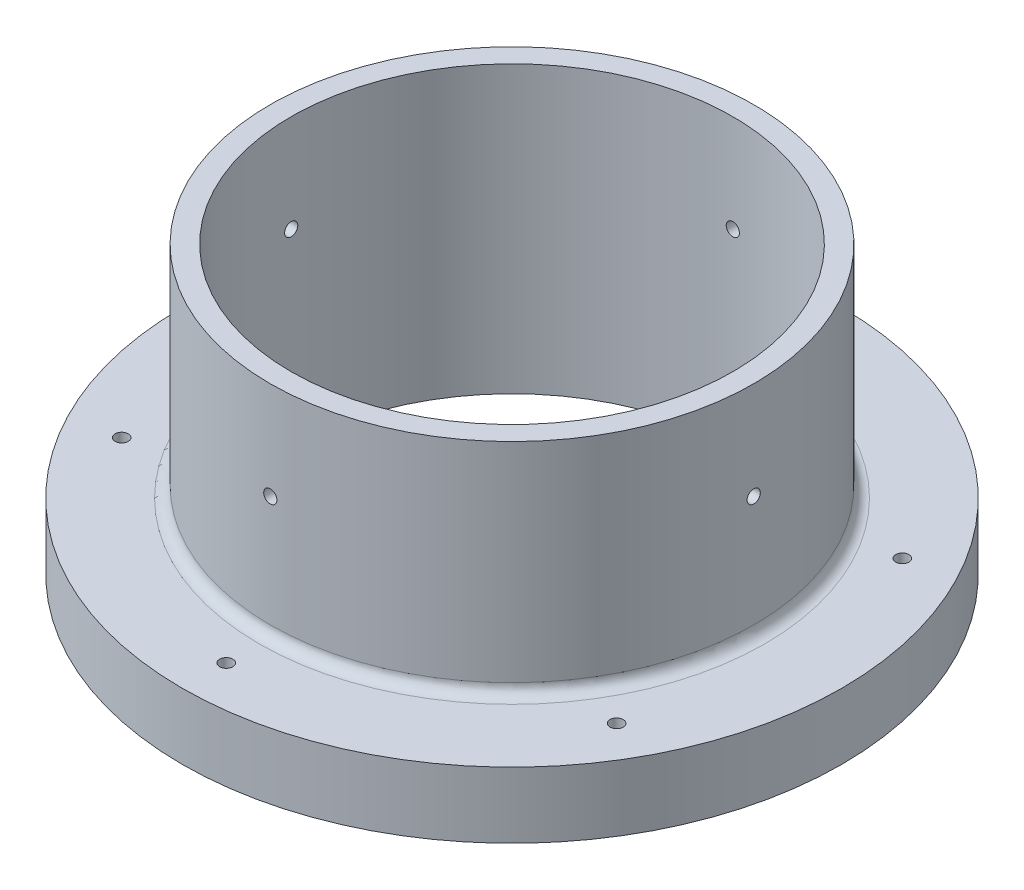
from build123d import *

# Parameters (mm, degrees)
SKETCH5_R               = 55
SKETCH5_R_2             = 50.25
BOSS_EXTRUDE1_DEPTH     = 50
CUT_EXTRUDE1_DEPTH      = 211
CUT_EXTRUDE1_DEPTH_BACK = 106
SKETCH8_R               = 1.5
CUT_EXTRUDE2_DEPTH      = 93.466210222
CUT_EXTRUDE2_DEPTH_BACK = 93.466210222
SKETCH9_R               = 1.5
SKETCH14_R              = 75
SKETCH14_R_2            = 50.25
BOSS_EXTRUDE4_DEPTH     = 15
FILLET3_R               = 2.5
SKETCH15_R              = 1.5
CUT_EXTRUDE3_DEPTH      = 125.398553098
CIRPATTERN1_COUNT       = 6


with BuildPart() as part:
    # Sketch5 → Boss-Extrude1 (new body)
    with BuildSketch(Plane(origin=(0, 0, 0), x_dir=(1, 0, 0), z_dir=(0, 1, 0))):
        with Locations(Location((0, 0, 0), (0, 0, 270))):
            Circle(SKETCH5_R)
        with Locations(Location((0, 0, 0), (0, 0, 270))):
            Circle(SKETCH5_R_2, mode=Mode.SUBTRACT)
    extrude(amount=BOSS_EXTRUDE1_DEPTH)

    # Sketch8 → Cut-Extrude1 (cut, two sides: drawn at the far end of the back side and taken through both)
    with BuildSketch(Plane(origin=(0, 0, 0), x_dir=(0, 0, -1), z_dir=(1, 0, 0)).offset(-CUT_EXTRUDE1_DEPTH_BACK)):
        with Locations(Location((0, 27.82, 0), (0, 0, 180))):
            Circle(SKETCH8_R)
    extrude(amount=CUT_EXTRUDE1_DEPTH + CUT_EXTRUDE1_DEPTH_BACK, mode=Mode.SUBTRACT)

    # Sketch9 → Cut-Extrude2 (cut, two sides: drawn at the far end of the back side and taken through both)
    with BuildSketch(Plane.XY.offset(-CUT_EXTRUDE2_DEPTH_BACK)):
        with Locations((0, 27.82)):
            Circle(SKETCH9_R)
    extrude(amount=CUT_EXTRUDE2_DEPTH + CUT_EXTRUDE2_DEPTH_BACK, mode=Mode.SUBTRACT)

    # Sketch14 → Boss-Extrude4 (add)
    with BuildSketch(Plane(origin=(0, -15, 0), x_dir=(1, 0, 0), z_dir=(0, 1, 0))):
        with Locations(Location((0, 0, 0), (0, 0, 270))):
            Circle(SKETCH14_R)
        with Locations(Location((0, 0, 0), (0, 0, 270))):
            Circle(SKETCH14_R_2, mode=Mode.SUBTRACT)
    extrude(amount=BOSS_EXTRUDE4_DEPTH)

    # Fillet3
    fillet3_edges = [part.edges().sort_by_distance(p)[0] for p in [
        (0, 0, -55),
    ]]
    fillet(fillet3_edges, radius=FILLET3_R)

    # Sketch15 → Cut-Extrude3 (cut, through all)
    with BuildSketch(Plane.XZ.offset(15)):
        with Locations(Location((0, 65, 0), (0, 0, 270))):
            Circle(SKETCH15_R)
    cut_extrude3 = extrude(amount=-CUT_EXTRUDE3_DEPTH, mode=Mode.SUBTRACT)

    # CirPattern1: Cut-Extrude3 ×6 about axis
    cirpattern1_axis = Axis((0, 0, 0), (0, 1, 0))
    for i in range(1, CIRPATTERN1_COUNT):
        add(cut_extrude3.rotate(cirpattern1_axis, i * 360 / CIRPATTERN1_COUNT), mode=Mode.SUBTRACT)


solid = part.part
